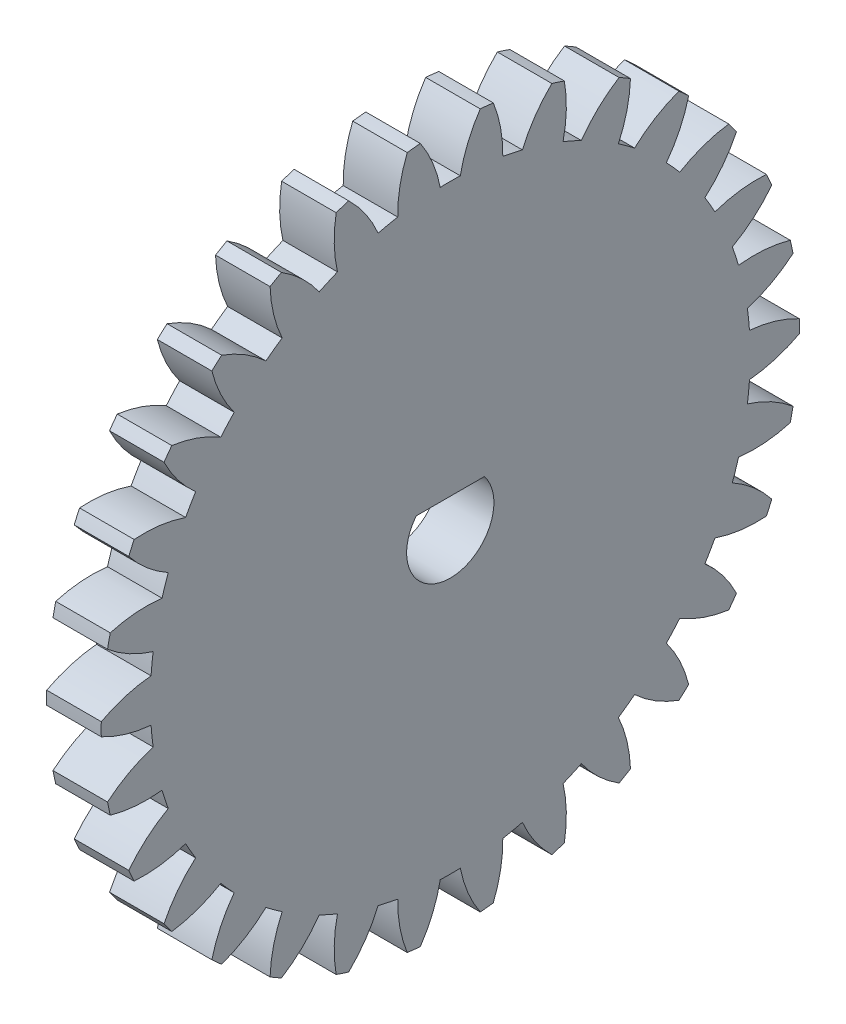
from build123d import *

# Parameters (mm, degrees)
BASPROSKE_W         = 5
BASPROSKE_H         = 32
TOOTHCUT_DEPTH      = 46.530209751
TEETHCUTS_COUNT     = 30
TEETHCUTS_ANGLE     = 348
BORSKE_R            = 4
BORE_DEPTH          = 50.0000508
BOSS_EXTRUDE1_DEPTH = 5


with BuildPart() as part:
    # BasProSke → Base-Revolve (revolve)
    with BuildSketch(Plane(origin=(0, 0, 0), x_dir=(1, 0, 0), z_dir=(0, 1, 0)), mode=Mode.PRIVATE) as base_revolve_sk:
        with Locations((2.5, 16)):
            Rectangle(BASPROSKE_W, BASPROSKE_H)
    revolve(base_revolve_sk.sketch.rotate(Axis((-10, 0, 0), (1, 0, 0)), 180), axis=Axis((-10, 0, 0), (1, 0, 0)))

    # TooCutSke → ToothCut (cut, through all)
    with BuildSketch(Plane(origin=(0, 0, 0), x_dir=(0, 0, -1), z_dir=(1, 0, 0))):
        with BuildLine():
            ThreePointArc((0.918551563, 27.483654488), (0, 27.499), (-0.918551563, 27.483654488))
            ThreePointArc((-0.918551563, 27.483654488), (-1.617208176, 29.787801627), (-2.761784709, 31.906093311))
            ThreePointArc((-2.761784709, 31.906093311), (0, 32.0254), (2.761784709, 31.906093311))
            ThreePointArc((2.761784709, 31.906093311), (1.617208176, 29.787801627), (0.918551563, 27.483654488))
        make_face()
    toothcut = extrude(amount=TOOTHCUT_DEPTH, mode=Mode.SUBTRACT)

    # TeethCuts: ToothCut ×30 about axis
    teethcuts_axis = Axis((-10, 0, 0), (1, 0, 0))
    for i in range(1, TEETHCUTS_COUNT):
        add(toothcut.rotate(teethcuts_axis, i * TEETHCUTS_ANGLE / (TEETHCUTS_COUNT - 1)), mode=Mode.SUBTRACT)

    # BorSke → Bore (cut, symmetric)
    with BuildSketch(Plane(origin=(0, 0, 0), x_dir=(0, 0, -1), z_dir=(1, 0, 0))):
        with Locations(Location((0, 0, 0), (0, 0, 180))):
            Circle(BORSKE_R)
    extrude(amount=BORE_DEPTH, both=True, mode=Mode.SUBTRACT)

    # Sketch1 → Boss-Extrude1 (add)
    with BuildSketch(Plane(origin=(5, 0, 0), x_dir=(0, 0, -1), z_dir=(1, 0, 0))):
        with BuildLine():
            Line((-3.122498999, 2.5), (3.122498999, 2.5))
            ThreePointArc((3.122498999, 2.5), (0, 4), (-3.122498999, 2.5))
        make_face()
    extrude(amount=-BOSS_EXTRUDE1_DEPTH)


solid = part.part
